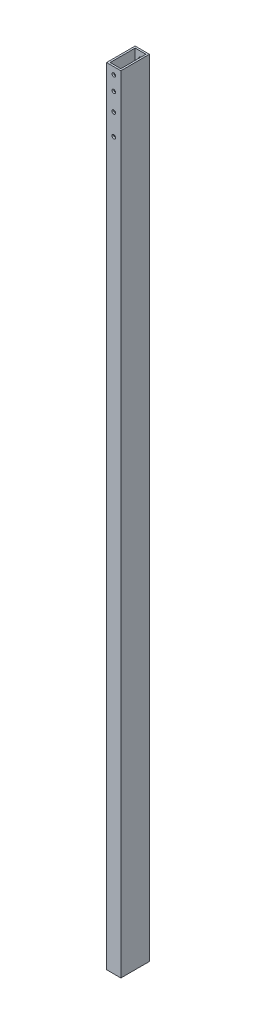
from build123d import *

# Parameters (mm, degrees)
SKETCH1_W               = 25.4
SKETCH1_H               = 50.8
SKETCH1_W_2             = 19.05
SKETCH1_H_2             = 44.45
BOSS_EXTRUDE1_DEPTH     = 1397
SKETCH2_R               = 3.2639
CUT_EXTRUDE1_DEPTH      = 1472.995197003
CUT_EXTRUDE2_DEPTH      = 1472.995197003
CUT_EXTRUDE2_DEPTH_BACK = 1472.995197003
SKETCH3_R               = 3.175


with BuildPart() as part:
    # Sketch1 → Boss-Extrude1 (new body)
    with BuildSketch(Plane(origin=(0, 25.4, 0), x_dir=(1, 0, 0), z_dir=(0, 1, 0))):
        with Locations((279.4, 215.9)):
            Rectangle(SKETCH1_W, SKETCH1_H)
        with Locations((279.4, 215.9)):
            Rectangle(SKETCH1_W_2, SKETCH1_H_2, mode=Mode.SUBTRACT)
    extrude(amount=BOSS_EXTRUDE1_DEPTH)

    # Sketch2 → Cut-Extrude1 (cut, through all)
    with BuildSketch(Plane.XY):
        with Locations((279.4, 1314.45)):
            Circle(SKETCH2_R)
        with Locations((279.4, 1352.55)):
            Circle(SKETCH2_R)
    extrude(amount=-CUT_EXTRUDE1_DEPTH, mode=Mode.SUBTRACT)

    # Sketch3 → Cut-Extrude2 (cut, two sides: drawn at the far end of the back side and taken through both)
    with BuildSketch(Plane.XY.offset(-CUT_EXTRUDE2_DEPTH_BACK)):
        with Locations((279.4, 1384.3)):
            Circle(SKETCH3_R)
        with Locations((279.4, 1409.7)):
            Circle(SKETCH3_R)
    extrude(amount=CUT_EXTRUDE2_DEPTH + CUT_EXTRUDE2_DEPTH_BACK, mode=Mode.SUBTRACT)


solid = part.part
